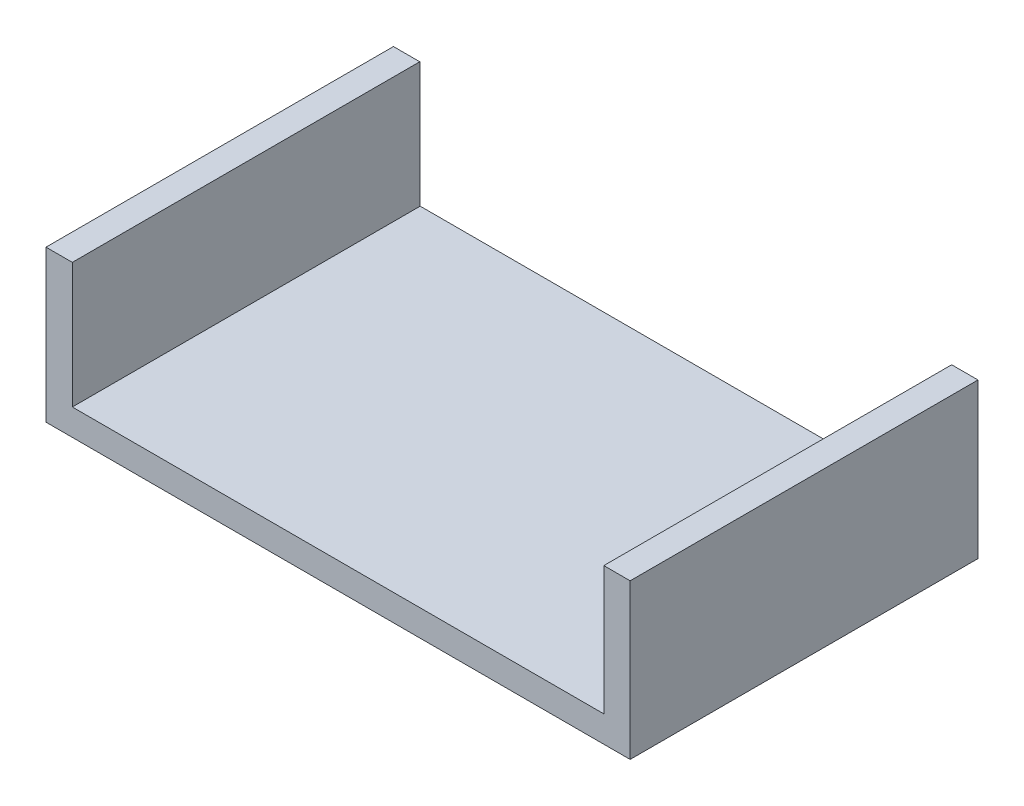
from build123d import *

# Parameters (mm, degrees)
SKETCH1_W           = 29.9974
SKETCH1_H           = 19.6342
BOSS_EXTRUDE1_DEPTH = 1.4859
SKETCH2_W           = 19.610793651
SKETCH2_H           = 8.55658582
BOSS_EXTRUDE2_DEPTH = 1.4859
SKETCH3_W           = 19.6342
SKETCH3_H           = 8.73321644
BOSS_EXTRUDE3_DEPTH = 1.4859


with BuildPart() as part:
    # Sketch1 → Boss-Extrude1 (new body)
    with BuildSketch(Plane(origin=(0, 0, 0), x_dir=(1, 0, 0), z_dir=(0, 1, 0))):
        Rectangle(SKETCH1_W, SKETCH1_H)
    extrude(amount=BOSS_EXTRUDE1_DEPTH)

    # Sketch2 → Boss-Extrude2 (add)
    with BuildSketch(Plane(origin=(-14.9987, 0, 0), x_dir=(0, 0, -1), z_dir=(1, 0, 0))):
        with Locations((-0.011703175, 4.27829291)):
            Rectangle(SKETCH2_W, SKETCH2_H)
    extrude(amount=-BOSS_EXTRUDE2_DEPTH)

    # Sketch3 → Boss-Extrude3 (add)
    with BuildSketch(Plane(origin=(14.9987, 0, 0), x_dir=(0, 0, -1), z_dir=(1, 0, 0))):
        with Locations((0, 4.36660822)):
            Rectangle(SKETCH3_W, SKETCH3_H)
    extrude(amount=BOSS_EXTRUDE3_DEPTH)


solid = part.part
